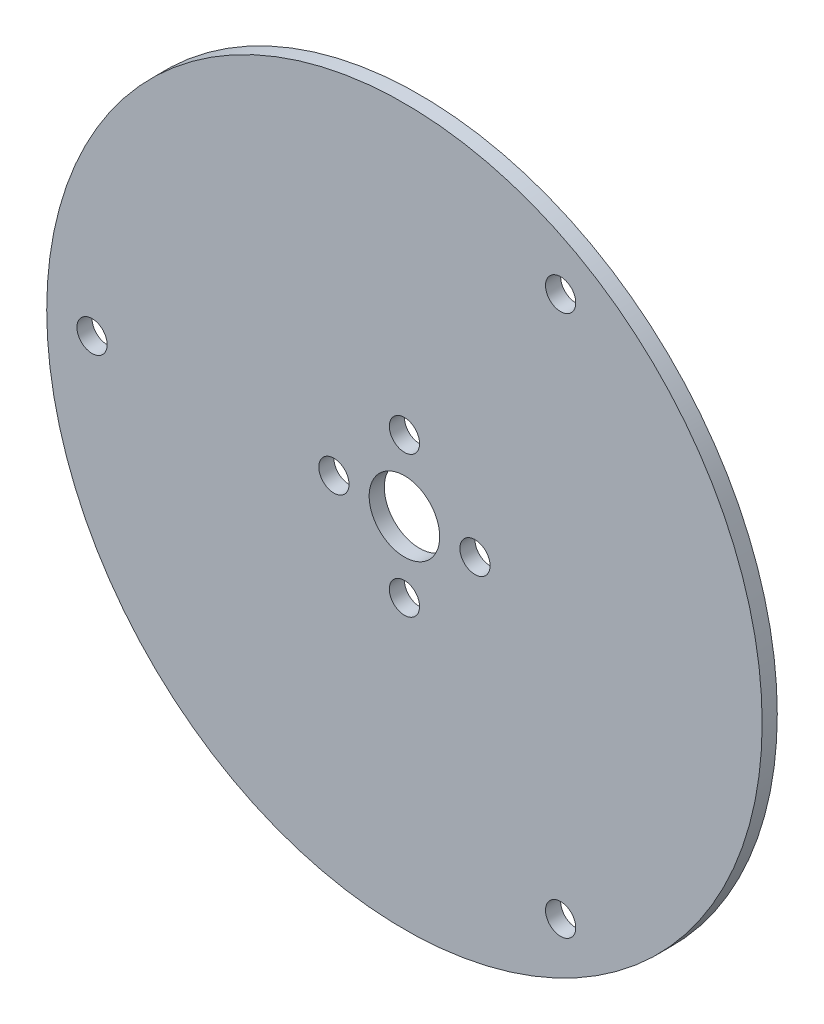
from build123d import *

# Parameters (mm, degrees)
SKETCH_1_R          = 35.5
EXTRUDE_1_DEPTH     = 1.5
SKETCH_2_R          = 3.5
CUT_EXTRUDE_1_DEPTH = 2
SKETCH_3_R          = 1.5
CUT_EXTRUDE_2_DEPTH = 2
SKETCH_5_R          = 1.5
CUT_EXTRUDE_3_DEPTH = 2


with BuildPart() as part:
    # 草图1 → 凸台-拉伸1 (new body)
    with BuildSketch(Plane.XY):
        Circle(SKETCH_1_R)
    extrude(amount=EXTRUDE_1_DEPTH)

    # 草图2 → 切除-拉伸1 (cut)
    with BuildSketch(Plane.XY.offset(1.5)):
        Circle(SKETCH_2_R)
    extrude(amount=-CUT_EXTRUDE_1_DEPTH, mode=Mode.SUBTRACT)

    # 草图3 → 切除-拉伸2 (cut)
    with BuildSketch(Plane.XY.offset(1.5)):
        with Locations((0, 7)):
            Circle(SKETCH_3_R)
        with Locations((7, 0)):
            Circle(SKETCH_3_R)
        with Locations((0, -7)):
            Circle(SKETCH_3_R)
        with Locations((-7, 0)):
            Circle(SKETCH_3_R)
    extrude(amount=-CUT_EXTRUDE_2_DEPTH, mode=Mode.SUBTRACT)

    # 草图5 → 切除-拉伸3 (cut)
    with BuildSketch(Plane.XY.offset(1.5)):
        with Locations((-31, 0)):
            Circle(SKETCH_5_R)
        with Locations((15.5, 26.846787517)):
            Circle(SKETCH_5_R)
        with Locations((15.5, -26.846787517)):
            Circle(SKETCH_5_R)
    extrude(amount=-CUT_EXTRUDE_3_DEPTH, mode=Mode.SUBTRACT)


solid = part.part
